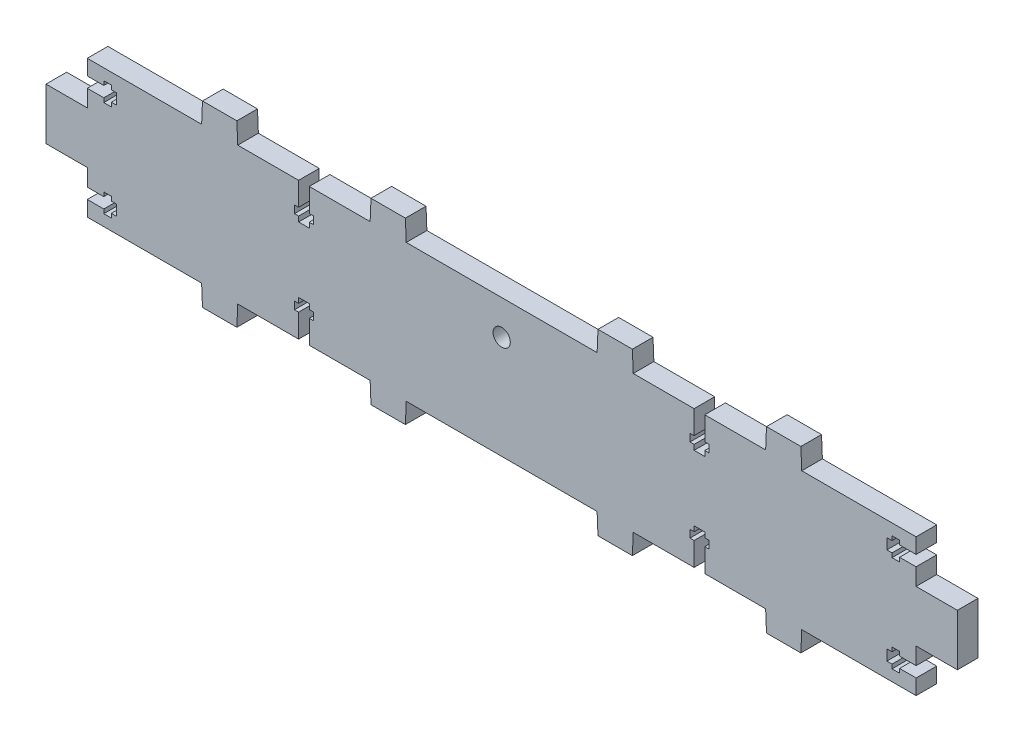
from build123d import *

# Parameters (mm, degrees)
SKETCH_1_R      = 2.5
EXTRUDE_1_DEPTH = 6


with BuildPart() as part:
    # Эскиз1 → Бобышка-Вытянуть1 (new body)
    with BuildSketch(Plane.XY):
        Polygon((-28, -26), (-27.75, -20), (27.75, -20), (28, -26), (38, -26), (38.25, -20), (43.45, -20), (55.95, -20), (55.95, -13.2), (54.75, -13.2), (54.75, -11), (55.95, -11), (55.95, -9.5), (59.05, -9.5), (59.05, -11), (60.25, -11), (60.25, -13.2), (59.05, -13.2), (59.05, -20), (64.25, -20), (76.75, -20), (77, -26), (87, -26), (87.25, -20), (120.5, -20), (120.5, -15.55), (115.7, -15.55), (115.7, -16.75), (113.5, -16.75), (113.5, -15.55), (112, -15.55), (112, -12.45), (113.5, -12.45), (113.5, -11.25), (115.7, -11.25), (115.7, -12.45), (120.5, -12.45), (120.5, -7.5), (132.5, -7.5), (132.5, 7.5), (120.5, 7.5), (120.5, 12.45), (115.7, 12.45), (115.7, 11.25), (113.5, 11.25), (113.5, 12.45), (112, 12.45), (112, 15.55), (113.5, 15.55), (113.5, 16.75), (115.7, 16.75), (115.7, 15.55), (120.5, 15.55), (120.5, 20), (87.25, 20), (87, 26), (77, 26), (76.75, 20), (64.25, 20), (59.05, 20), (59.05, 13.2), (60.25, 13.2), (60.25, 11), (59.05, 11), (59.05, 9.5), (55.95, 9.5), (55.95, 11), (54.75, 11), (54.75, 13.2), (55.95, 13.2), (55.95, 20), (43.45, 20), (38.25, 20), (38, 26), (28, 26), (27.75, 20), (-27.75, 20), (-28, 26), (-38, 26), (-38.25, 20), (-43.45, 20), (-55.95, 20), (-55.95, 13.2), (-54.75, 13.2), (-54.75, 11), (-55.95, 11), (-55.95, 9.5), (-59.05, 9.5), (-59.05, 11), (-60.25, 11), (-60.25, 13.2), (-59.05, 13.2), (-59.05, 20), (-71.55, 20), (-76.75, 20), (-77, 26), (-87, 26), (-87.25, 20), (-120.5, 20), (-120.5, 15.55), (-115.7, 15.55), (-115.7, 16.75), (-113.5, 16.75), (-113.5, 15.55), (-112, 15.55), (-112, 12.45), (-113.5, 12.45), (-113.5, 11.25), (-115.7, 11.25), (-115.7, 12.45), (-120.5, 12.45), (-120.5, 7.5), (-132.5, 7.5), (-132.5, -7.5), (-120.5, -7.5), (-120.5, -12.45), (-115.7, -12.45), (-115.7, -11.25), (-113.5, -11.25), (-113.5, -12.45), (-112, -12.45), (-112, -15.55), (-113.5, -15.55), (-113.5, -16.75), (-115.7, -16.75), (-115.7, -15.55), (-120.5, -15.55), (-120.5, -20), (-87.25, -20), (-87, -26), (-77, -26), (-76.75, -20), (-71.55, -20), (-59.05, -20), (-59.05, -13.2), (-60.25, -13.2), (-60.25, -11), (-59.05, -11), (-59.05, -9.5), (-55.95, -9.5), (-55.95, -11), (-54.75, -11), (-54.75, -13.2), (-55.95, -13.2), (-55.95, -20), (-43.45, -20), (-38.25, -20), (-38, -26), align=None)
        with Locations((0, 10)):
            Circle(SKETCH_1_R, mode=Mode.SUBTRACT)
    extrude(amount=EXTRUDE_1_DEPTH)


solid = part.part
